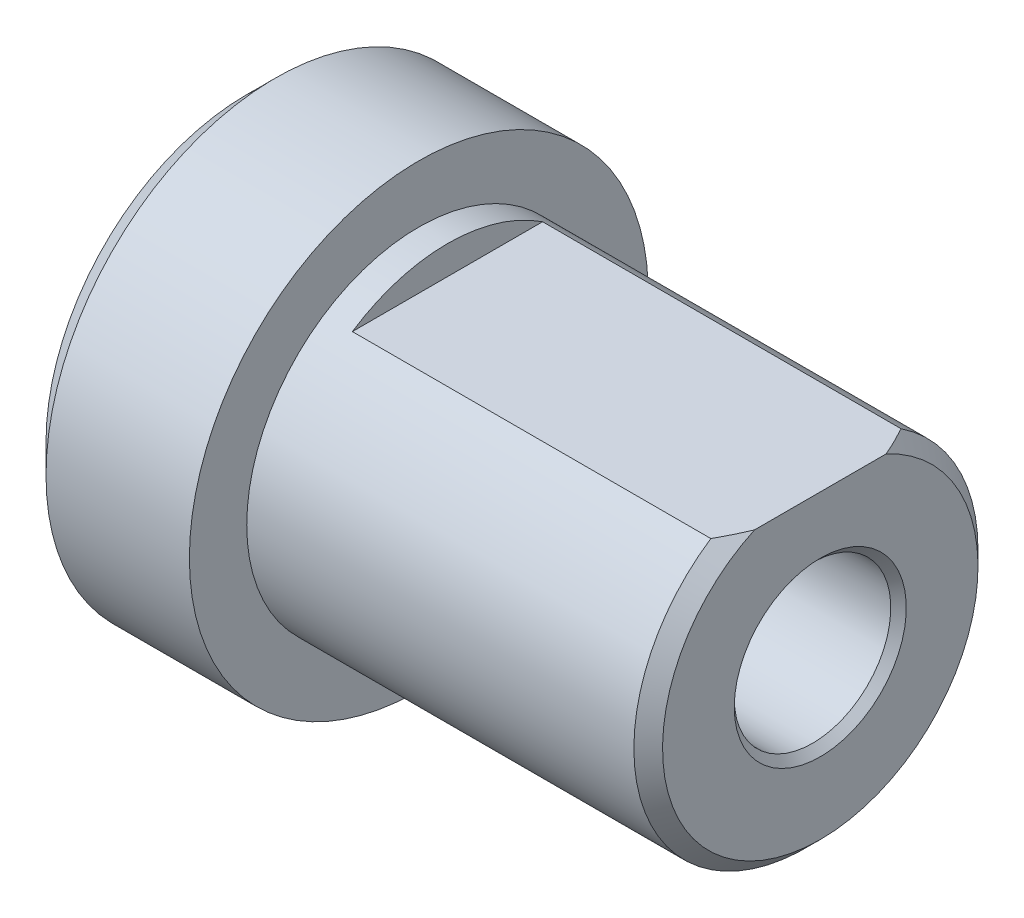
from build123d import *

# Parameters (mm, degrees)
SKETCH_2_W          = 6.5
SKETCH_2_H          = 8
CUT_EXTRUDE_1_DEPTH = 3


with BuildPart() as part:
    # 草图1 → 旋转1 (revolve)
    with BuildSketch(Plane.XY):
        Polygon((-10, 1.5), (-9.8645, 1.3645), (-0.1355, 1.3645), (0, 1.5), (0, 3), (-7, 3), (-7, 4), (-9.5, 4), (-10, 3.5), align=None)
    revolve(axis=Axis((0, 0, 0), (-1, 0, 0)))

    # 草图2 → 切除-拉伸1 (cut)
    with BuildSketch(Plane(origin=(0, 2.5, 0), x_dir=(1, 0, 0), z_dir=(0, 1, 0))):
        with Locations((-3.25, 0)):
            Rectangle(SKETCH_2_W, SKETCH_2_H)
    extrude(amount=CUT_EXTRUDE_1_DEPTH, mode=Mode.SUBTRACT)

    # 草图3 → 切除-旋转1 (revolve, cut)
    with BuildSketch(Plane.XY):
        Polygon((-0.25, 3), (0, 2.75), (0, 3), align=None)
    revolve(axis=Axis((0, 0, 0), (-1, 0, 0)), mode=Mode.SUBTRACT)


solid = part.part
